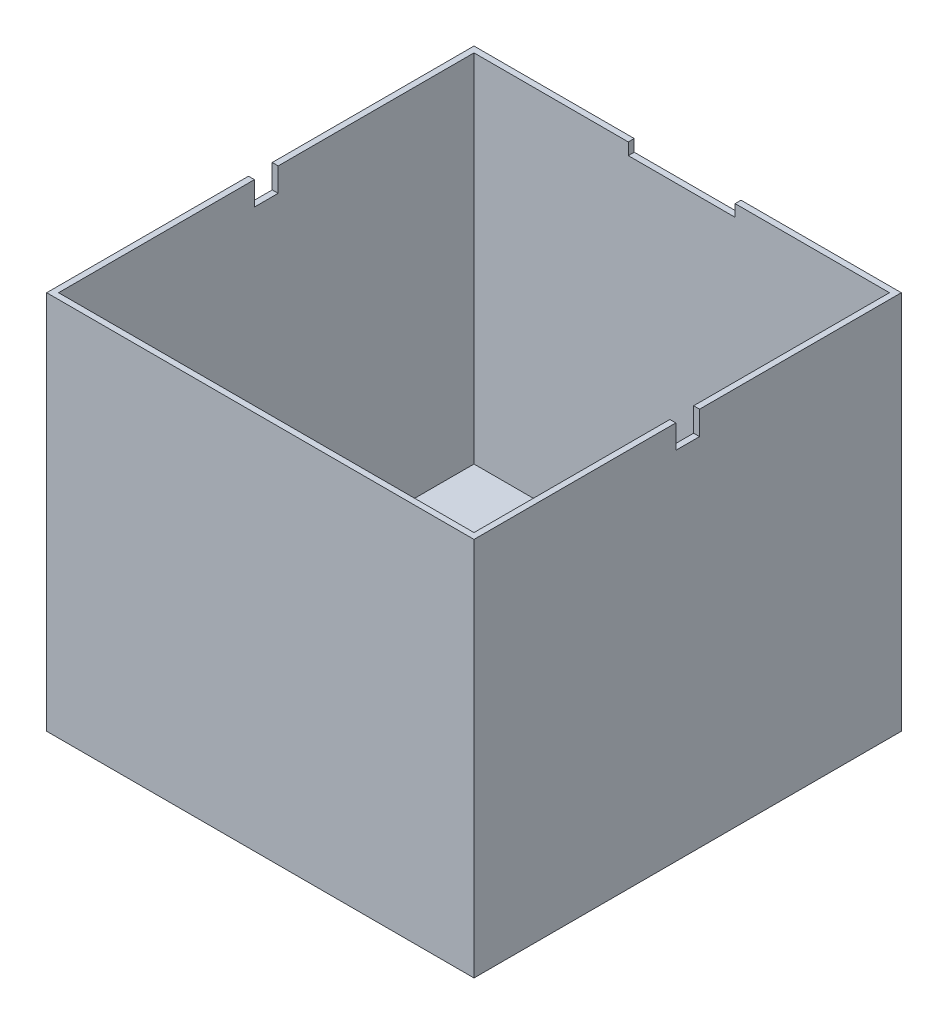
from build123d import *

# Parameters (mm, degrees)
BOSS_EXTRUDE1_DEPTH      = 150
BOSS_EXTRUDE1_DEPTH_BACK = 5
SKETCH1_W                = 180
SKETCH1_H                = 180
SKETCH6_W                = 175
SKETCH6_H                = 175
CUT_EXTRUDE2_DEPTH       = 150
SKETCH34_W               = 180
SKETCH34_H               = 180
BOSS_EXTRUDE14_DEPTH     = 5
SKETCH35_W               = 15.2
SKETCH35_H               = 15.2
CUT_EXTRUDE11_DEPTH      = 5
SKETCH37_W               = 14.2
SKETCH37_H               = 14.2
CUT_EXTRUDE12_DEPTH      = 5
MIRROR13_COPY_1_SKETCH_W = 15.2
MIRROR13_COPY_1_SKETCH_H = 15.2
MIRROR13_COPY_1_DEPTH    = 5
MIRROR13_COPY_2_SKETCH_W = 14.2
MIRROR13_COPY_2_SKETCH_H = 14.2
MIRROR13_COPY_2_DEPTH    = 5
SKETCH15_W               = 10
SKETCH15_H               = 10
CUT_EXTRUDE7_DEPTH       = 3
SKETCH21_W               = 50
SKETCH21_H               = 3
BOSS_EXTRUDE7_DEPTH      = 10
SKETCH22_W               = 2.5
SKETCH22_H               = 10
BOSS_EXTRUDE8_DEPTH      = 5
SKETCH30_W               = 45
SKETCH30_H               = 2.5
CUT_EXTRUDE9_DEPTH       = 5
SKETCH38_W               = 70.2
SKETCH38_H               = 70.2
CUT_EXTRUDE13_DEPTH      = 5
SKETCH7_R                = 25.65
CUT_EXTRUDE14_DEPTH      = 5
CUT_EXTRUDE16_START      = -1.5
SKETCH39_R               = 27.15
CUT_EXTRUDE16_DEPTH      = 2


with BuildPart() as part:
    # Sketch1 → Boss-Extrude1 (new, two sides: drawn at the far end of the back side and taken through both)
    with BuildSketch(Plane(origin=(0, 0, 0), x_dir=(1, 0, 0), z_dir=(0, 1, 0)).offset(-BOSS_EXTRUDE1_DEPTH_BACK)):
        Rectangle(SKETCH1_W, SKETCH1_H)
    extrude(amount=BOSS_EXTRUDE1_DEPTH + BOSS_EXTRUDE1_DEPTH_BACK)

    # Sketch6 → Cut-Extrude2 (cut)
    with BuildSketch(Plane(origin=(0, 150, 0), x_dir=(1, 0, 0), z_dir=(0, 1, 0))):
        Rectangle(SKETCH6_W, SKETCH6_H)
    extrude(amount=-CUT_EXTRUDE2_DEPTH, mode=Mode.SUBTRACT)

    # Sketch34 → Boss-Extrude14 (add)
    with BuildSketch(Plane.XZ.offset(5)):
        Rectangle(SKETCH34_W, SKETCH34_H)
    extrude(amount=BOSS_EXTRUDE14_DEPTH)

    # Sketch35 → Cut-Extrude11 (cut)
    with BuildSketch(Plane.XZ.offset(10)):
        with Locations((-75.5, 75.5)):
            Rectangle(SKETCH35_W, SKETCH35_H)
    cut_extrude11 = extrude(amount=-CUT_EXTRUDE11_DEPTH, mode=Mode.SUBTRACT)

    # Sketch37 → Cut-Extrude12 (cut)
    with BuildSketch(Plane(origin=(0, 0, 0), x_dir=(1, 0, 0), z_dir=(0, 1, 0))):
        with Locations((-55.5, -33.75)):
            Rectangle(SKETCH37_W, SKETCH37_H)
    cut_extrude12 = extrude(amount=-CUT_EXTRUDE12_DEPTH, mode=Mode.SUBTRACT)

    # Mirror12: Cut-Extrude11, Cut-Extrude12 across plane
    add(cut_extrude11.mirror(Plane.XY), mode=Mode.SUBTRACT)
    add(cut_extrude12.mirror(Plane.XY), mode=Mode.SUBTRACT)

    # Mirror13: Cut-Extrude11, Cut-Extrude12 across plane
    add(cut_extrude11.mirror(Plane(origin=(0, 0, 0), x_dir=(0, 0, 1), z_dir=(1, 0, 0))), mode=Mode.SUBTRACT)
    add(cut_extrude12.mirror(Plane(origin=(0, 0, 0), x_dir=(0, 0, 1), z_dir=(1, 0, 0))), mode=Mode.SUBTRACT)

    # Mirror13 copy 1 sketch → Mirror13 copy 1 (cut)
    with BuildSketch(Plane(origin=(0, -10, 0), x_dir=(-1, 0, 0), z_dir=(0, -1, 0))):
        with Locations((-75.5, 75.5)):
            Rectangle(MIRROR13_COPY_1_SKETCH_W, MIRROR13_COPY_1_SKETCH_H)
    extrude(amount=-MIRROR13_COPY_1_DEPTH, mode=Mode.SUBTRACT)

    # Mirror13 copy 2 sketch → Mirror13 copy 2 (cut)
    with BuildSketch(Plane(origin=(0, 0, 0), x_dir=(-1, 0, 0), z_dir=(0, 1, 0))):
        with Locations((-55.5, -33.75)):
            Rectangle(MIRROR13_COPY_2_SKETCH_W, MIRROR13_COPY_2_SKETCH_H)
    extrude(amount=-MIRROR13_COPY_2_DEPTH, mode=Mode.SUBTRACT)

    # Sketch15 → Cut-Extrude7 (cut)
    with BuildSketch(Plane(origin=(90, 0, 0), x_dir=(0, 0, -1), z_dir=(1, 0, 0))):
        with Locations((0.004832502, 145)):
            Rectangle(SKETCH15_W, SKETCH15_H)
    cut_extrude7 = extrude(amount=-CUT_EXTRUDE7_DEPTH, mode=Mode.SUBTRACT)

    # Mirror3: Cut-Extrude7 across plane
    add(cut_extrude7.mirror(Plane(origin=(0, 0, 0), x_dir=(0, 0, 1), z_dir=(1, 0, 0))), mode=Mode.SUBTRACT)

    # Sketch21 → Boss-Extrude7 (add)
    with BuildSketch(Plane(origin=(0, 0, 87.5), x_dir=(-1, 0, 0), z_dir=(0, 0, -1))):
        with Locations((0.003304144, 88.502007714)):
            Rectangle(SKETCH21_W, SKETCH21_H)
    extrude(amount=BOSS_EXTRUDE7_DEPTH)

    # Sketch22 → Boss-Extrude8 (add)
    with BuildSketch(Plane(origin=(0, 90.002007714, 0), x_dir=(1, 0, 0), z_dir=(0, 1, 0))):
        with Locations((-23.753304144, -82.5)):
            Rectangle(SKETCH22_W, SKETCH22_H)
    boss_extrude8 = extrude(amount=BOSS_EXTRUDE8_DEPTH)

    # Mirror7: Boss-Extrude8 across plane
    add(boss_extrude8.mirror(Plane(origin=(0, 0, 0), x_dir=(0, 0, 1), z_dir=(1, 0, 0))))

    # Sketch30 → Cut-Extrude9 (cut)
    with BuildSketch(Plane(origin=(0, 150, 0), x_dir=(1, 0, 0), z_dir=(0, 1, 0))):
        with Locations((0.002512985, 88.75)):
            Rectangle(SKETCH30_W, SKETCH30_H)
    extrude(amount=-CUT_EXTRUDE9_DEPTH, mode=Mode.SUBTRACT)

    # Sketch38 → Cut-Extrude13 (cut)
    with BuildSketch(Plane(origin=(0, 0, 0), x_dir=(1, 0, 0), z_dir=(0, 1, 0))):
        Rectangle(SKETCH38_W, SKETCH38_H)
    extrude(amount=-CUT_EXTRUDE13_DEPTH, mode=Mode.SUBTRACT)

    # Sketch7 → Cut-Extrude14 (cut)
    with BuildSketch(Plane(origin=(0, -5, 0), x_dir=(1, 0, 0), z_dir=(0, 1, 0))):
        with Locations(Location((0, 0, 0), (0, 0, 270))):
            Circle(SKETCH7_R)
    extrude(amount=-CUT_EXTRUDE14_DEPTH, mode=Mode.SUBTRACT)

    # Sketch39 → Cut-Extrude16 (cut)
    with BuildSketch(Plane(origin=(0, -5, 0), x_dir=(1, 0, 0), z_dir=(0, 1, 0)).offset(CUT_EXTRUDE16_START)):
        with Locations(Location((0, 0, 0), (0, 0, 270))):
            Circle(SKETCH39_R)
    extrude(amount=-CUT_EXTRUDE16_DEPTH, mode=Mode.SUBTRACT)


solid = part.part
